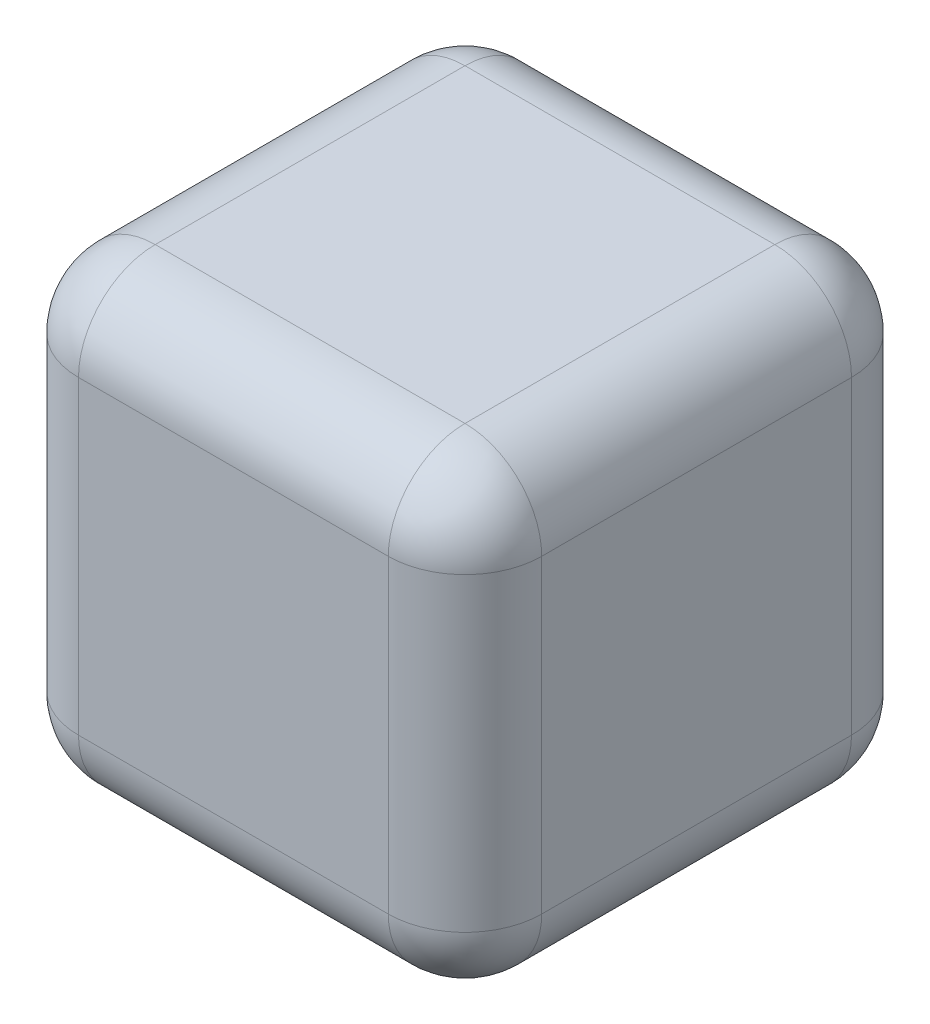
from build123d import *

# Parameters (mm, degrees)
SKETCH1_W           = 64
SKETCH1_H           = 64
BOSS_EXTRUDE1_DEPTH = 64
FILLET1_R           = 10.6


with BuildPart() as part:
    # Sketch1 → Boss-Extrude1 (new body)
    with BuildSketch(Plane.XY):
        Rectangle(SKETCH1_W, SKETCH1_H)
    extrude(amount=BOSS_EXTRUDE1_DEPTH)

    # Fillet1
    fillet1_edges = [part.edges().sort_by_distance(p)[0] for p in [
        (-32, 0, 64),
        (0, -32, 64),
        (32, 0, 64),
        (0, -32, 0),
        (-32, 0, 0),
        (0, 32, 0),
        (32, 0, 0),
        (0, 32, 64),
        (32, -32, 32),
        (-32, -32, 32),
        (-32, 32, 32),
        (32, 32, 32),
    ]]
    fillet(fillet1_edges, radius=FILLET1_R)


solid = part.part
